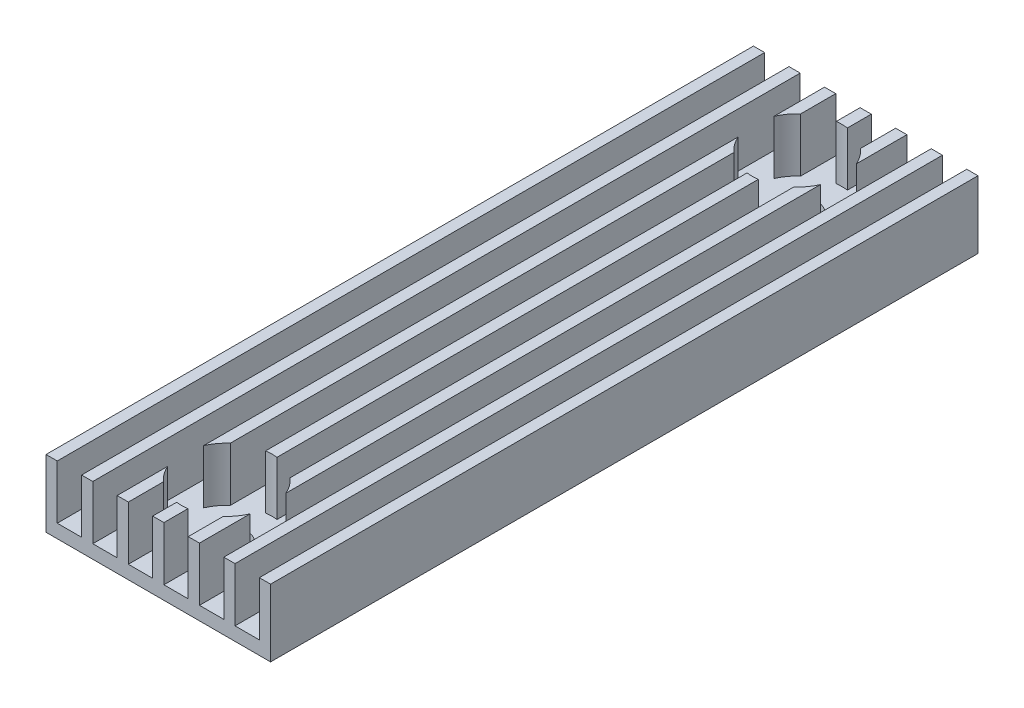
from build123d import *

# Parameters (mm, degrees)
BOSS_EXTRUDE1_DEPTH     = 63
CUT_EXTRUDE2_DEPTH      = 65.070273919
CUT_EXTRUDE2_DEPTH_BACK = 65.070273919
SKETCH2_R               = 1.75
CUT_EXTRUDE3_START      = 1.2
SKETCH3_R               = 4
CUT_EXTRUDE3_DEPTH      = 63


with BuildPart() as part:
    # Sketch1 → Boss-Extrude1 (new body)
    with BuildSketch(Plane.XY):
        Polygon((-10, 6), (-10, 0), (10, 0), (10, 6), (9, 6), (9, 1.2), (6.833333333, 1.2), (6.833333333, 6), (5.833333333, 6), (5.833333333, 1.2), (3.666666667, 1.2), (3.666666667, 6), (2.666666667, 6), (2.666666667, 1.2), (0.5, 1.2), (0.5, 6), (-0.5, 6), (-0.5, 1.2), (-2.666666667, 1.2), (-2.666666667, 6), (-3.666666667, 6), (-3.666666667, 1.2), (-5.833333333, 1.2), (-5.833333333, 6), (-6.833333333, 6), (-6.833333333, 1.2), (-9, 1.2), (-9, 6), align=None)
    extrude(amount=-BOSS_EXTRUDE1_DEPTH)

    # Sketch2 → Cut-Extrude2 (cut, two sides: drawn at the far end of the back side and taken through both)
    with BuildSketch(Plane(origin=(0, 0, 0), x_dir=(1, 0, 0), z_dir=(0, 1, 0)).offset(-CUT_EXTRUDE2_DEPTH_BACK)):
        with Locations(Location((0, 56.9, 0), (0, 0, 253.398450401))):
            Circle(SKETCH2_R)
        with Locations(Location((0, 6.1, 0), (0, 0, 253.398450401))):
            Circle(SKETCH2_R)
    extrude(amount=CUT_EXTRUDE2_DEPTH + CUT_EXTRUDE2_DEPTH_BACK, mode=Mode.SUBTRACT)

    # Sketch3 → Cut-Extrude3 (cut)
    with BuildSketch(Plane(origin=(0, 0, 0), x_dir=(1, 0, 0), z_dir=(0, 1, 0)).offset(CUT_EXTRUDE3_START)):
        with Locations((0, 56.9)):
            Circle(SKETCH3_R)
        with Locations((0, 6.1)):
            Circle(SKETCH3_R)
    extrude(amount=CUT_EXTRUDE3_DEPTH, mode=Mode.SUBTRACT)


solid = part.part
